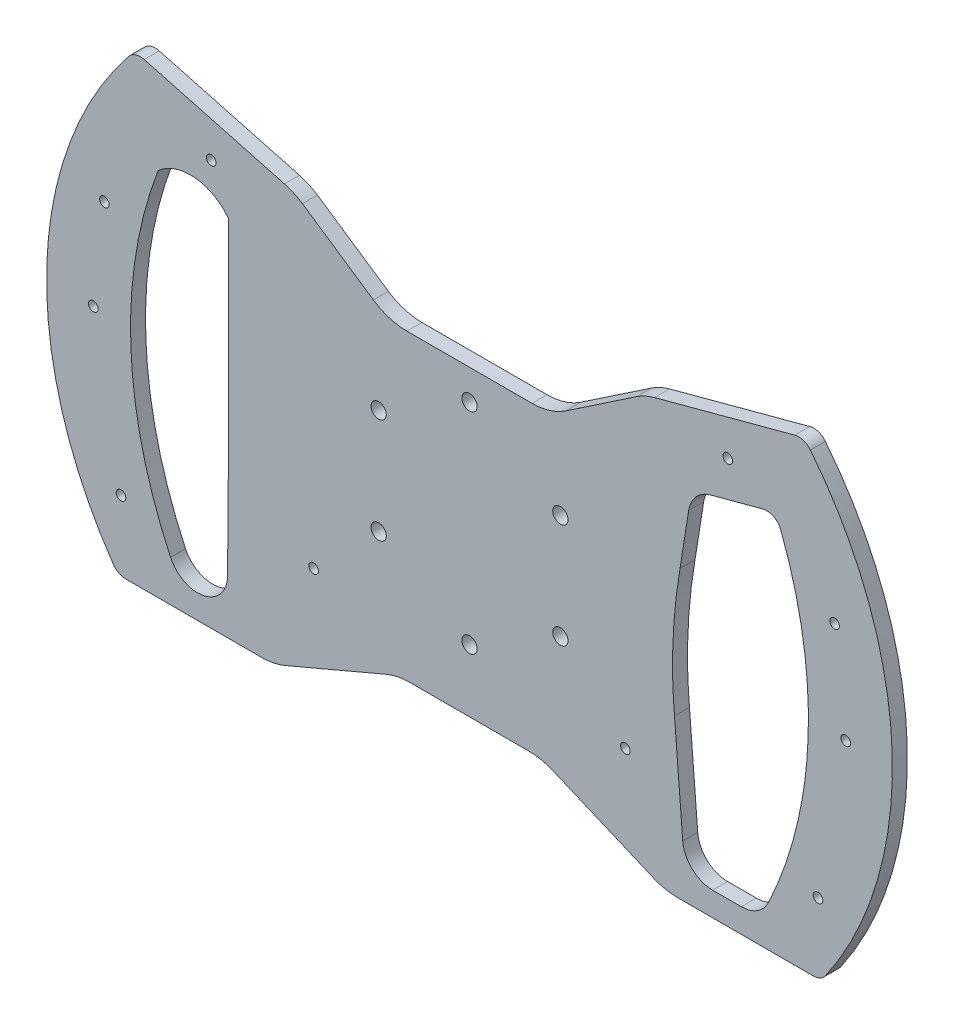
from build123d import *

# Parameters (mm, degrees)
SKETCH7_R           = 1.6
SKETCH7_R_2         = 2.55
BOSS_EXTRUDE2_DEPTH = 5


with BuildPart() as part:
    # Sketch7 → Boss-Extrude2 (new body)
    with BuildSketch(Plane(origin=(-155.165218795, 0, 0), x_dir=(1, 0, 0), z_dir=(0, 0, 1))):
        with BuildLine():
            ThreePointArc((186.769671741, 167.286880781), (181.433247766, 164.741537113), (175.585813672, 163.867632232))
            Line((175.585813672, 163.867632232), (133.81504093, 163.867632232))
            ThreePointArc((133.81504093, 163.867632232), (127.967606836, 164.741537113), (122.631182861, 167.286880781))
            Line((122.631182861, 167.286880781), (98.971665752, 183.245426575))
            ThreePointArc((98.971665752, 183.245426575), (96.081672536, 184.863900542), (92.964188585, 185.98319165))
            Line((92.964188585, 185.98319165), (46.183315852, 198.51808872))
            ThreePointArc((46.183315852, 198.51808872), (43.329318726, 198.438902311), (40.983947586, 196.81077323))
            ThreePointArc((40.983947586, 196.81077323), (13.687864292, 122.997631993), (35.910853464, 47.501971622))
            ThreePointArc((35.910853464, 47.501971622), (37.700666361, 45.921987917), (40.019050269, 45.352010045))
            Line((40.019050269, 45.352010045), (85.367161343, 45.352010045))
            ThreePointArc((85.367161343, 45.352010045), (89.354520031, 45.753515952), (93.181783913, 46.941912976))
            Line((93.181783913, 46.941912976), (126.95485072, 61.277729301))
            ThreePointArc((126.95485072, 61.277729301), (130.782114601, 62.466126325), (134.769473289, 62.867632232))
            Line((134.769473289, 62.867632232), (174.631381312, 62.867632232))
            ThreePointArc((174.631381312, 62.867632232), (178.618740001, 62.466126325), (182.446003882, 61.277729301))
            Line((182.446003882, 61.277729301), (216.219070689, 46.941912976))
            ThreePointArc((216.219070689, 46.941912976), (220.04633457, 45.753515952), (224.033693259, 45.352010045))
            Line((224.033693259, 45.352010045), (269.381804333, 45.352010045))
            ThreePointArc((269.381804333, 45.352010045), (271.70018824, 45.921987917), (273.490001138, 47.501971622))
            ThreePointArc((273.490001138, 47.501971622), (295.712990309, 122.997631993), (268.416907015, 196.81077323))
            ThreePointArc((268.416907015, 196.81077323), (266.071535876, 198.438902311), (263.217538749, 198.51808872))
            Line((263.217538749, 198.51808872), (216.436666017, 185.98319165))
            ThreePointArc((216.436666017, 185.98319165), (213.319182066, 184.863900542), (210.42918885, 183.245426575))
            Line((210.42918885, 183.245426575), (186.769671741, 167.286880781))
        make_face()
        with Locations((38.436607979, 68.752932179)):
            Circle(SKETCH7_R, mode=Mode.SUBTRACT)
        with Locations((102.700427301, 79.752932179)):
            Circle(SKETCH7_R, mode=Mode.SUBTRACT)
        with Locations((29.203576285, 118.752932179)):
            Circle(SKETCH7_R, mode=Mode.SUBTRACT)
        with BuildLine():
            ThreePointArc((50.870986739, 168.810905662), (63.047418465, 172.817129133), (74.292978733, 166.664675124))
            Line((74.292978733, 166.664675124), (74.292978733, 100.280747179))
            Line((74.292978733, 100.280747179), (73.980283138, 62.561010441))
            ThreePointArc((73.980283138, 62.561010441), (70.797263007, 56.006603452), (64.011616245, 53.352010045))
            ThreePointArc((64.011616245, 53.352010045), (58.655129241, 54.907600831), (54.965142603, 59.09040065))
            ThreePointArc((54.965142603, 59.09040065), (48.044160974, 76.816977425), (43.591061483, 95.318366989))
            ThreePointArc((43.591061483, 95.318366989), (42.297615396, 132.553323304), (50.870986739, 168.810905662))
        make_face(mode=Mode.SUBTRACT)
        with Locations((124.389538168, 101.252932179)):
            Circle(SKETCH7_R_2, mode=Mode.SUBTRACT)
        with Locations((206.700427301, 79.752932179)):
            Circle(SKETCH7_R, mode=Mode.SUBTRACT)
        with Locations((270.964246623, 68.752932179)):
            Circle(SKETCH7_R, mode=Mode.SUBTRACT)
        with Locations((154.700427301, 83.752932179)):
            Circle(SKETCH7_R_2, mode=Mode.SUBTRACT)
        with Locations((185.011316433, 101.252932179)):
            Circle(SKETCH7_R_2, mode=Mode.SUBTRACT)
        with BuildLine():
            Line((235.107875868, 167.174775102), (252.566315963, 171.852750026))
            ThreePointArc((252.566315963, 171.852750026), (256.132298182, 171.477167312), (258.529867862, 168.810905662))
            ThreePointArc((258.529867862, 168.810905662), (263.529184961, 153.009876594), (266.626244503, 136.728785929))
            add(Edge.make_bspline(
                [(266.626244503, 136.728785929), (269.27120455, 115.705359984), (265.809793118, 95.318366989)],
                knots=[0, 0, 0, 0.881934454, 0.881934454, 0.881934454], degree=2))
            ThreePointArc((265.809793118, 95.318366989), (265.318661666, 92.589710086), (264.773591938, 89.871313942))
            ThreePointArc((264.773591938, 89.871313942), (260.500059228, 74.180131562), (254.435711999, 59.09040065))
            ThreePointArc((254.435711999, 59.09040065), (250.745725361, 54.907600831), (245.389238357, 53.352010045))
            Line((245.389238357, 53.352010045), (235.807999121, 53.352010045))
            ThreePointArc((235.807999121, 53.352010045), (229.022352359, 56.006603452), (225.839332228, 62.561010441))
            Line((225.839332228, 62.561010441), (223.081153151, 97.32129138))
            add(Edge.make_bspline(
                [(222.846324523, 100.280747179), (222.950560925, 98.800835847), (223.081153151, 97.32129138)],
                knots=[0.931930938, 0.931930938, 0.931930938, 1, 1, 1], degree=2))
            add(Edge.make_bspline(
                [(224.932331274, 140.872333064), (221.419227915, 120.542156926), (222.846324523, 100.280747179)],
                knots=[0, 0, 0, 0.931930938, 0.931930938, 0.931930938], degree=2))
            Line((224.932331274, 140.872333064), (227.819439706, 159.081481956))
            ThreePointArc((227.819439706, 159.081481956), (230.265167007, 164.207432514), (235.107875868, 167.174775102))
        make_face(mode=Mode.SUBTRACT)
        with Locations((280.197278317, 118.752932179)):
            Circle(SKETCH7_R, mode=Mode.SUBTRACT)
        with Locations((32.909775986, 150.752932179)):
            Circle(SKETCH7_R, mode=Mode.SUBTRACT)
        with Locations((124.389538168, 136.252932179)):
            Circle(SKETCH7_R_2, mode=Mode.SUBTRACT)
        with Locations((68.540177705, 180.621909566)):
            Circle(SKETCH7_R, mode=Mode.SUBTRACT)
        with Locations((185.011316433, 136.252932179)):
            Circle(SKETCH7_R_2, mode=Mode.SUBTRACT)
        with Locations((154.700427301, 153.752932179)):
            Circle(SKETCH7_R_2, mode=Mode.SUBTRACT)
        with Locations((276.491078616, 150.752932179)):
            Circle(SKETCH7_R, mode=Mode.SUBTRACT)
        with Locations((240.860676897, 180.621909566)):
            Circle(SKETCH7_R, mode=Mode.SUBTRACT)
    extrude(amount=BOSS_EXTRUDE2_DEPTH)


solid = part.part
